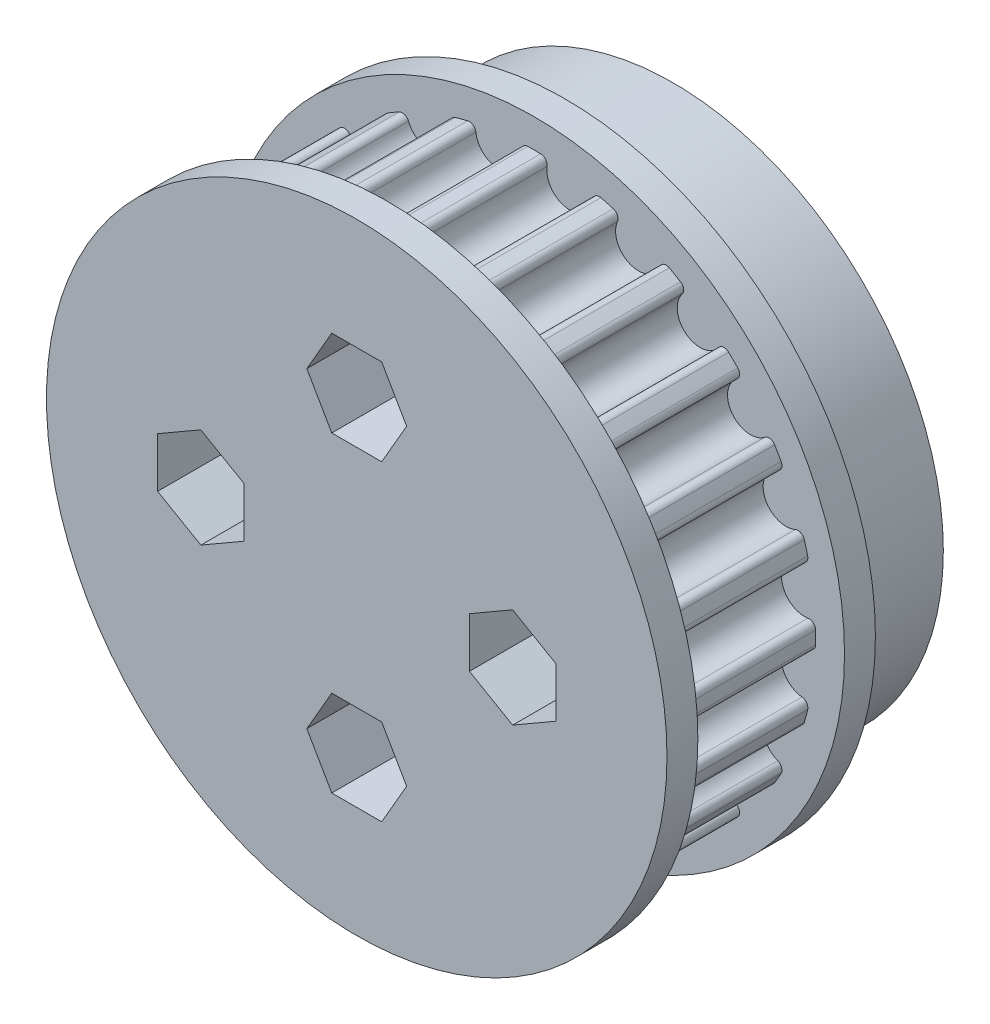
from build123d import *

# Parameters (mm, degrees)
SKETCH1_R           = 19.098593171
BOSS_EXTRUDE1_DEPTH = 4.75
CUT_EXTRUDE1_DEPTH  = 29.631495284
CIRPATTERN1_COUNT   = 24
SKETCH3_R           = 20.098593171
BOSS_EXTRUDE2_DEPTH = 2
SKETCH5_R           = 17.5
BOSS_EXTRUDE3_DEPTH = 7
SKETCH4_R           = 1.6
CUT_EXTRUDE2_DEPTH  = 36.045069481
CUT_EXTRUDE4_DEPTH  = 6


with BuildPart() as part:
    # Sketch1 → Boss-Extrude1 (new, symmetric)
    with BuildSketch(Plane.XY):
        Circle(SKETCH1_R)
    extrude(amount=BOSS_EXTRUDE1_DEPTH, both=True)

    # Sketch2 → Cut-Extrude1 (cut, through all)
    with BuildSketch(Plane.XY.offset(4.75)):
        with BuildLine():
            Line((0, 18.228593171), (0, 19.098593171))
            ThreePointArc((0, 19.098593171), (2.492866643, 18.935202059), (4.943079647, 18.44782439))
            Line((4.943079647, 18.44782439), (4.717907078, 17.607468921))
            ThreePointArc((4.717907078, 17.607468921), (4.516571179, 17.660186686), (4.314646513, 17.710602318))
            ThreePointArc((4.314646513, 17.710602318), (3.966573687, 17.64529778), (3.785563861, 17.340905241))
            ThreePointArc((3.785563861, 17.340905241), (2.1104249, 16.030268615), (0.831582635, 17.729804248))
            ThreePointArc((0.831582635, 17.729804248), (0.735523156, 18.070673652), (0.416212682, 18.223840868))
            ThreePointArc((0.416212682, 18.223840868), (0.208119906, 18.227405057), (0, 18.228593171))
        make_face()
    cut_extrude1 = extrude(amount=-CUT_EXTRUDE1_DEPTH, mode=Mode.SUBTRACT)

    # CirPattern1: Cut-Extrude1 ×24 about axis
    cirpattern1_axis = Axis((0, 0, 0), (0, 0, 1))
    for i in range(1, CIRPATTERN1_COUNT):
        add(cut_extrude1.rotate(cirpattern1_axis, i * 360 / CIRPATTERN1_COUNT), mode=Mode.SUBTRACT)

    # Sketch3 → Boss-Extrude2 (add)
    with BuildSketch(Plane.XY.offset(4.75)):
        Circle(SKETCH3_R)
    boss_extrude2 = extrude(amount=BOSS_EXTRUDE2_DEPTH)

    # Mirror1: Boss-Extrude2 across plane
    add(boss_extrude2.mirror(Plane.XY))

    # Sketch5 → Boss-Extrude3 (add)
    with BuildSketch(Plane.XY.offset(-6.75)):
        Circle(SKETCH5_R)
    extrude(amount=-BOSS_EXTRUDE3_DEPTH)

    # Sketch4 → Cut-Extrude2 (cut, through all)
    with BuildSketch(Plane.XY.offset(6.75)):
        with Locations((0, 10.098593171)):
            Circle(SKETCH4_R)
        with Locations((10.098593171, 0)):
            Circle(SKETCH4_R)
        with Locations((0, -10.098593171)):
            Circle(SKETCH4_R)
        with Locations((-10.098593171, 0)):
            Circle(SKETCH4_R)
    extrude(amount=-CUT_EXTRUDE2_DEPTH, mode=Mode.SUBTRACT)

    # Sketch8 → Cut-Extrude4 (cut)
    with BuildSketch(Plane.XY.offset(6.75)):
        Polygon((3.233161507, 10.098593171), (1.616580754, 12.898593171), (-1.616580754, 12.898593171), (-3.233161507, 10.098593171), (-1.616580754, 7.298593171), (1.616580754, 7.298593171), align=None)
        Polygon((12.898593171, -1.616580754), (12.898593171, 1.616580754), (10.098593171, 3.233161507), (7.298593171, 1.616580754), (7.298593171, -1.616580754), (10.098593171, -3.233161507), align=None)
        Polygon((3.233161507, -10.098593171), (1.616580754, -7.298593171), (-1.616580754, -7.298593171), (-3.233161507, -10.098593171), (-1.616580754, -12.898593171), (1.616580754, -12.898593171), align=None)
        Polygon((-7.298593171, -1.616580754), (-7.298593171, 1.616580754), (-10.098593171, 3.233161507), (-12.898593171, 1.616580754), (-12.898593171, -1.616580754), (-10.098593171, -3.233161507), align=None)
    extrude(amount=-CUT_EXTRUDE4_DEPTH, mode=Mode.SUBTRACT)


solid = part.part
